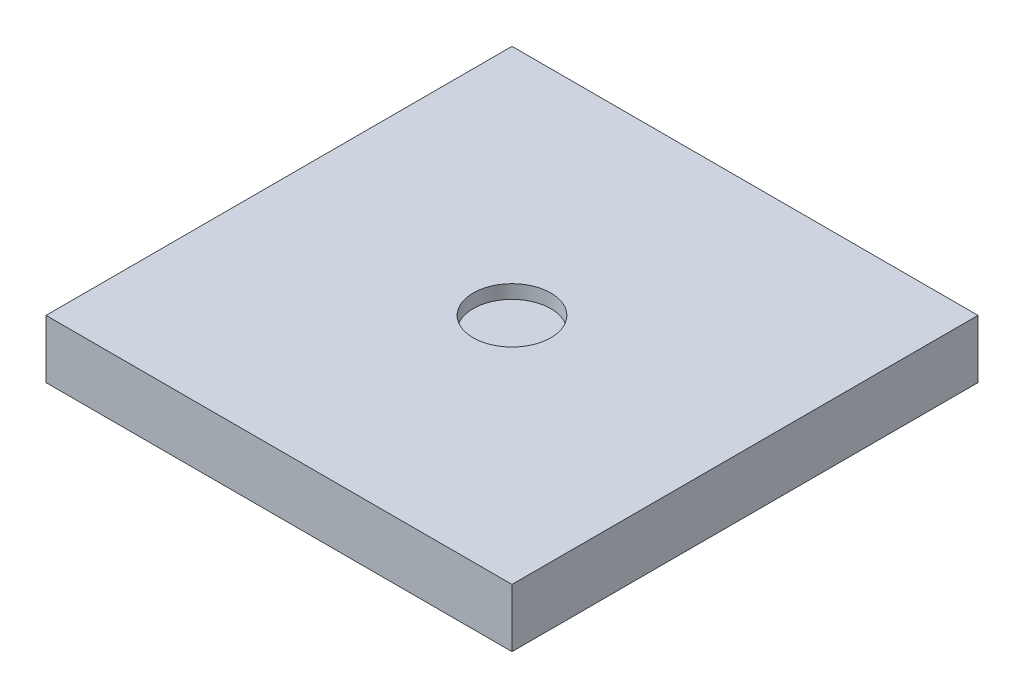
from build123d import *

# Parameters (mm, degrees)
SKETCH2_W           = 152.4
SKETCH2_H           = 152.4
BOSS_EXTRUDE1_DEPTH = 19.05
SKETCH3_R           = 12.7
CUT_EXTRUDE1_DEPTH  = 4.445


with BuildPart() as part:
    # Sketch2 → Boss-Extrude1 (new body)
    with BuildSketch(Plane(origin=(0, 0, 0), x_dir=(1, 0, 0), z_dir=(0, 1, 0))):
        Rectangle(SKETCH2_W, SKETCH2_H)
    extrude(amount=BOSS_EXTRUDE1_DEPTH)

    # Sketch3 → Cut-Extrude1 (cut)
    with BuildSketch(Plane(origin=(0, 19.05, 0), x_dir=(1, 0, 0), z_dir=(0, 1, 0))):
        with Locations(Location((0, 0, 0), (0, 0, 270))):
            Circle(SKETCH3_R)
    extrude(amount=-CUT_EXTRUDE1_DEPTH, mode=Mode.SUBTRACT)


solid = part.part
